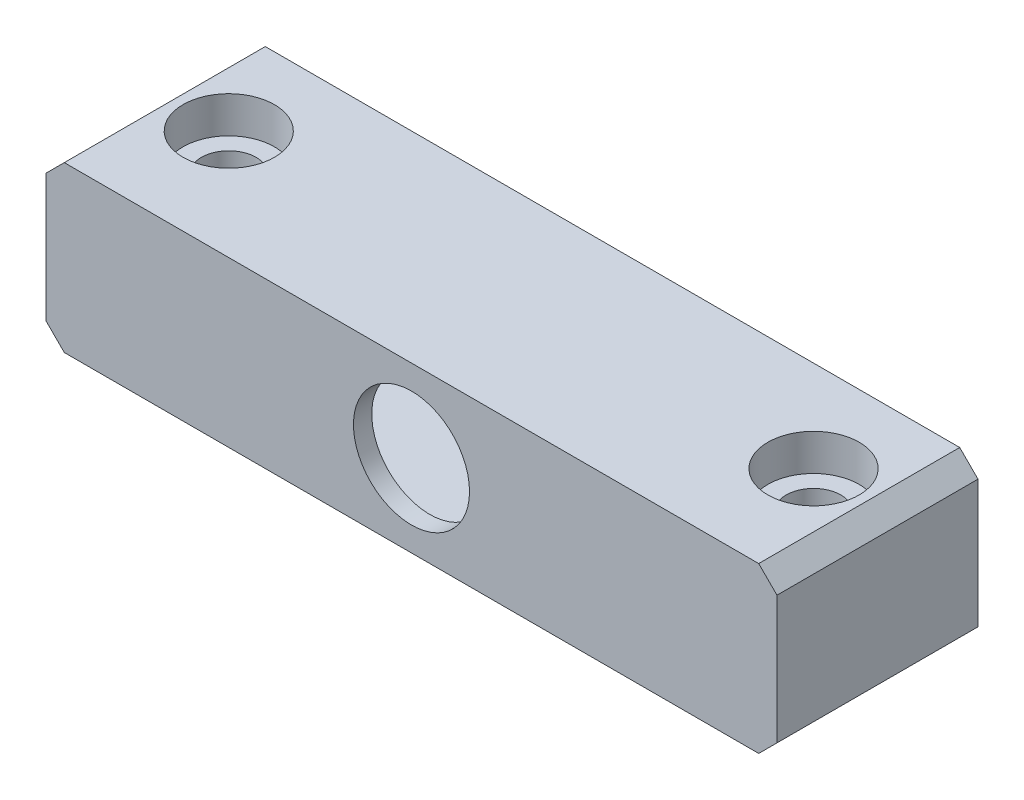
from build123d import *

# Parameters (mm, degrees)
BOSS_EXTRUDE1_DEPTH = 5
BOSS_EXTRUDE2_START = 5
SKETCH2_2_W         = 40
SKETCH2_2_H         = 9
BOSS_EXTRUDE2_DEPTH = 1
CUT_EXTRUDE1_REACH  = 25.265
SKETCH3_R           = 3.175
SKETCH7_R           = 2.5
CUT_EXTRUDE2_DEPTH  = 2
SKETCH7_3_R         = 1.5
CUT_EXTRUDE3_DEPTH  = 23.737634002
CHAMFER1_SIZE       = 1


with BuildPart() as part:
    # Sketch2 → Boss-Extrude1 (new, symmetric)
    with BuildSketch(Plane.XY):
        Polygon((-10, 4.5), (10, 4.5), (20, 4.5), (20, -4.5), (10, -4.5), (-10, -4.5), (-20, -4.5), (-20, 4.5), align=None)
        with BuildLine():
            Line((-10, 3.5), (10, 3.5))
            ThreePointArc((10, 3.5), (13.5, 0), (10, -3.5))
            Line((10, -3.5), (-10, -3.5))
            ThreePointArc((-10, -3.5), (-13.5, 0), (-10, 3.5))
        make_face(mode=Mode.SUBTRACT)
    extrude(amount=BOSS_EXTRUDE1_DEPTH, both=True)

    # Sketch2<2> → Boss-Extrude2 (add)
    with BuildSketch(Plane.XY.offset(BOSS_EXTRUDE2_START)):
        Rectangle(SKETCH2_2_W, SKETCH2_2_H)
    extrude(amount=BOSS_EXTRUDE2_DEPTH)

    # Sketch3 → Cut-Extrude1 (cut, up to next)
    with BuildSketch(Plane.XY.offset(6), mode=Mode.PRIVATE) as cut_extrude1_sk1:
        Circle(SKETCH3_R)
    cut_extrude1_tool1 = extrude(cut_extrude1_sk1.sketch, amount=-CUT_EXTRUDE1_REACH, mode=Mode.PRIVATE) & part.part
    add(cut_extrude1_tool1.solids().sort_by_distance((0, 0, 6))[0], mode=Mode.SUBTRACT)

    # Sketch7 → Cut-Extrude2 (cut)
    with BuildSketch(Plane(origin=(0, 4.5, 0), x_dir=(1, 0, 0), z_dir=(0, 1, 0))):
        with Locations((-16, 0)):
            Circle(SKETCH7_R)
        with Locations((16, 0)):
            Circle(SKETCH7_R)
    extrude(amount=-CUT_EXTRUDE2_DEPTH, mode=Mode.SUBTRACT)

    # Sketch7<3> → Cut-Extrude3 (cut, through all)
    with BuildSketch(Plane(origin=(0, 4.5, 0), x_dir=(1, 0, 0), z_dir=(0, 1, 0))):
        with Locations((-16, 0)):
            Circle(SKETCH7_3_R)
        with Locations((16, 0)):
            Circle(SKETCH7_3_R)
    extrude(amount=-CUT_EXTRUDE3_DEPTH, mode=Mode.SUBTRACT)

    # Chamfer1
    chamfer1_edges = [part.edges().sort_by_distance(p)[0] for p in [
        (-20, -4.5, 0.5),
        (20, -4.5, 0.5),
        (20, 4.5, 0.5),
        (-20, 4.5, 0.5),
    ]]
    chamfer(chamfer1_edges, length=CHAMFER1_SIZE)


solid = part.part
